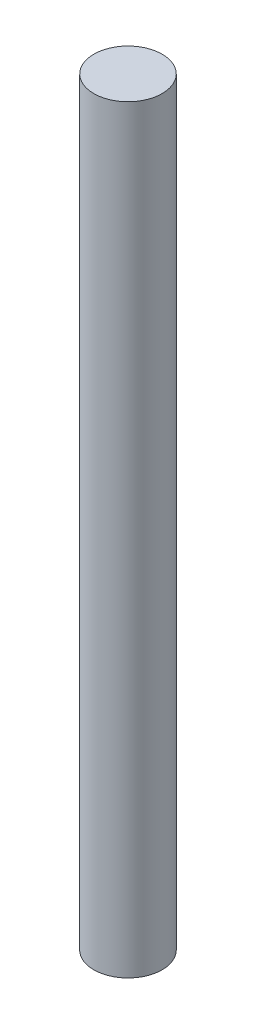
from build123d import *

# Parameters (mm, degrees)
SKETCH_1_R      = 2.25
EXTRUDE_1_DEPTH = 50


with BuildPart() as part:
    # 草图1 → 凸台-拉伸1 (new body)
    with BuildSketch(Plane(origin=(0, 0, 0), x_dir=(1, 0, 0), z_dir=(0, 1, 0))):
        with Locations(Location((0, 0, 0), (0, 0, 270))):
            Circle(SKETCH_1_R)
    extrude(amount=EXTRUDE_1_DEPTH)


solid = part.part
